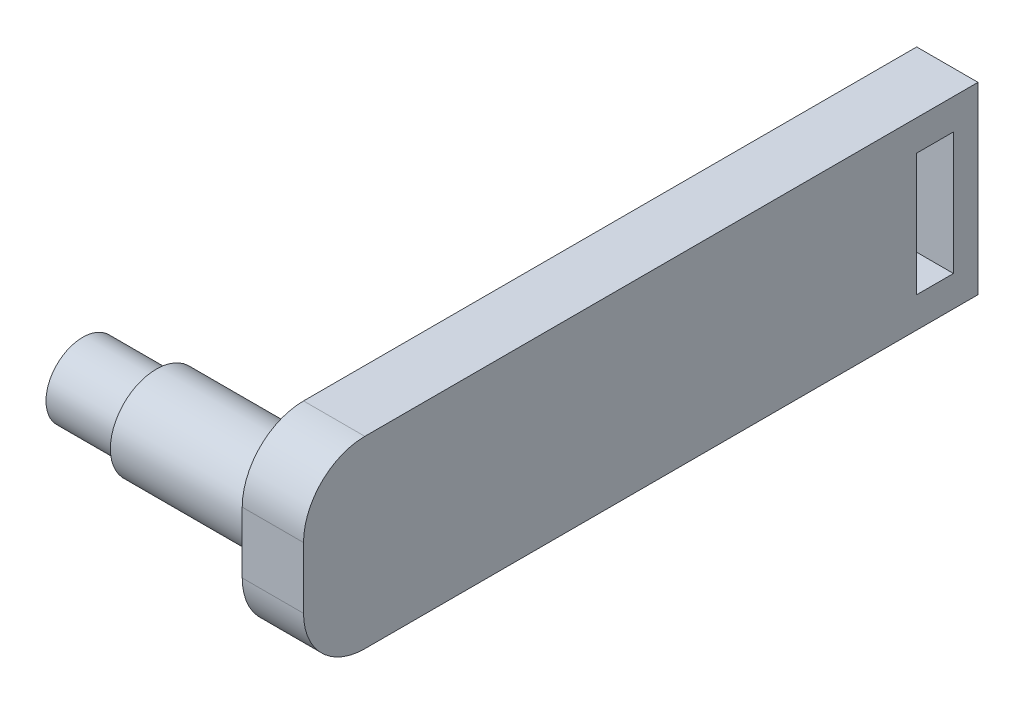
from build123d import *

# Parameters (mm, degrees)
SKETCH1_W           = 5
SKETCH1_H           = 55
BOSS_EXTRUDE1_DEPTH = 15
FILLET1_R           = 5
SKETCH2_W           = 3
SKETCH2_H           = 10
CUT_EXTRUDE1_DEPTH  = 5
SKETCH3_R           = 3.75
BOSS_EXTRUDE2_DEPTH = 12
SKETCH4_R           = 3
SKETCH4_R_2         = 1.75
BOSS_EXTRUDE3_DEPTH = 6


with BuildPart() as part:
    # Sketch1 → Boss-Extrude1 (new body)
    with BuildSketch(Plane(origin=(0, 0, 0), x_dir=(1, 0, 0), z_dir=(0, 1, 0))):
        with Locations((-59.380536913, 1.290268456)):
            Rectangle(SKETCH1_W, SKETCH1_H)
    extrude(amount=BOSS_EXTRUDE1_DEPTH)

    # Fillet1
    fillet1_edges = [part.edges().sort_by_distance(p)[0] for p in [
        (-59.380536913, 15, 26.209731544),
        (-59.380536913, 0, 26.209731544),
    ]]
    fillet(fillet1_edges, radius=FILLET1_R)

    # Sketch2 → Cut-Extrude1 (cut)
    with BuildSketch(Plane.ZY.offset(61.880536913)):
        with Locations((-25.290268456, 7.5)):
            Rectangle(SKETCH2_W, SKETCH2_H)
    extrude(amount=-CUT_EXTRUDE1_DEPTH, mode=Mode.SUBTRACT)

    # Sketch3 → Boss-Extrude2 (add)
    with BuildSketch(Plane.ZY.offset(61.880536913)):
        with Locations((21.209731544, 7.5)):
            Circle(SKETCH3_R)
    extrude(amount=BOSS_EXTRUDE2_DEPTH)

    # Sketch4 → Boss-Extrude3 (add)
    with BuildSketch(Plane.ZY.offset(73.880536913)):
        with Locations((21.209731544, 7.5)):
            Circle(SKETCH4_R)
        with Locations((21.209731544, 7.5)):
            Circle(SKETCH4_R_2, mode=Mode.SUBTRACT)
    extrude(amount=BOSS_EXTRUDE3_DEPTH)


solid = part.part
